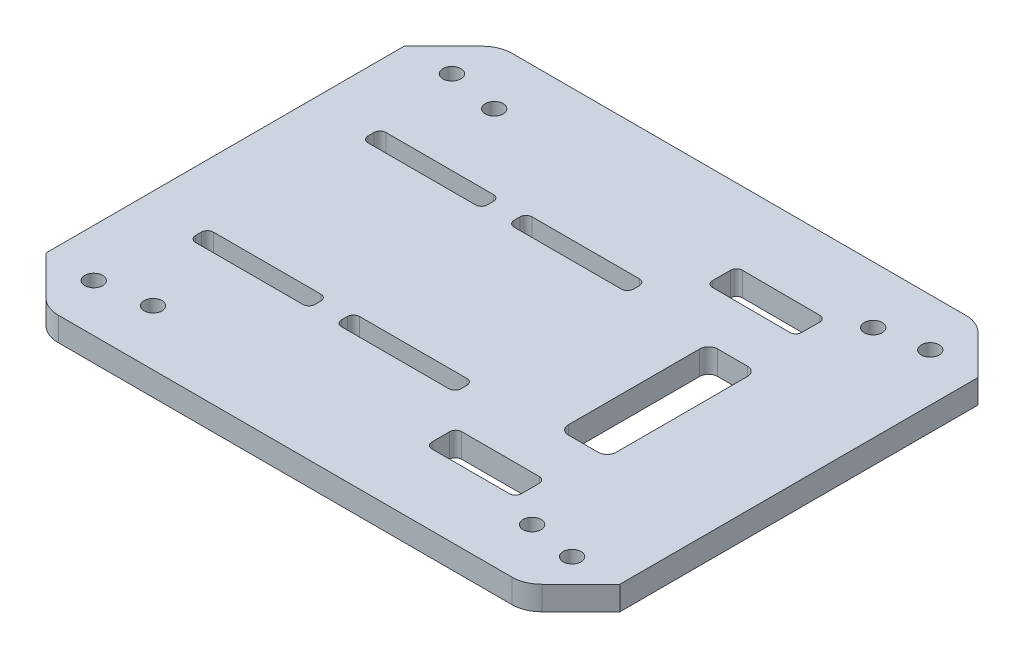
from build123d import *

# Parameters (mm, degrees)
SKETCH1_R           = 1.5
BOSS_EXTRUDE1_DEPTH = 4
SKETCH2_R           = 1.5
CUT_EXTRUDE1_DEPTH  = 10


with BuildPart() as part:
    # Sketch1 → Boss-Extrude1 (new body)
    with BuildSketch(Plane(origin=(0, 0, 0), x_dir=(1, 0, 0), z_dir=(0, 1, 0))):
        with BuildLine():
            Line((-48.071067812, 30), (-48.071067812, -30))
            Line((-48.071067812, -30), (-41.535533906, -36.535533906))
            ThreePointArc((-41.535533906, -36.535533906), (-39.913417162, -37.619397663), (-38, -38))
            Line((-38, -38), (38, -38))
            ThreePointArc((38, -38), (39.913417162, -37.619397663), (41.535533906, -36.535533906))
            Line((41.535533906, -36.535533906), (48.071067812, -30))
            Line((48.071067812, -30), (48.071067812, 30))
            Line((48.071067812, 30), (41.535533906, 36.535533906))
            ThreePointArc((41.535533906, 36.535533906), (39.913417162, 37.619397663), (38, 38))
            Line((38, 38), (-38, 38))
            ThreePointArc((-38, 38), (-39.913417162, 37.619397663), (-41.535533906, 36.535533906))
            Line((-41.535533906, 36.535533906), (-48.071067812, 30))
        make_face()
        with Locations(Location((32.059596398, -28.691611003, 0), (0, 0, 270))):
            Circle(SKETCH1_R, mode=Mode.SUBTRACT)
        with Locations(Location((32.059596398, 28.458388997, 0), (0, 0, 270))):
            Circle(SKETCH1_R, mode=Mode.SUBTRACT)
        with Locations(Location((-31.440403602, -28.691611003, 0), (0, 0, 270))):
            Circle(SKETCH1_R, mode=Mode.SUBTRACT)
        with Locations(Location((-31.440403602, 28.458388997, 0), (0, 0, 270))):
            Circle(SKETCH1_R, mode=Mode.SUBTRACT)
        with BuildLine():
            Line((26.770818028, 21.768665175), (26.783167828, 24.768639755))
            ThreePointArc((26.783167828, 24.768639755), (26.493187967, 25.476946269), (25.787292902, 25.772747882))
            Line((25.787292902, 25.772747882), (12.787403054, 25.826263684))
            ThreePointArc((12.787403054, 25.826263684), (12.07909654, 25.536283823), (11.783294927, 24.830388757))
            Line((11.783294927, 24.830388757), (11.770945126, 21.830414177))
            ThreePointArc((11.770945126, 21.830414177), (12.060924988, 21.122107663), (12.766820053, 20.82630605))
            Line((12.766820053, 20.82630605), (25.766709901, 20.772790248))
            ThreePointArc((25.766709901, 20.772790248), (26.475016415, 21.062770109), (26.770818028, 21.768665175))
        make_face(mode=Mode.SUBTRACT)
        with BuildLine():
            Line((28.613064126, -11.166765747), (28.613064126, 10.833234253))
            ThreePointArc((28.613064126, 10.833234253), (28.173724298, 11.893894425), (27.113064126, 12.333234253))
            Line((27.113064126, 12.333234253), (22.113064126, 12.333234253))
            ThreePointArc((22.113064126, 12.333234253), (21.052403954, 11.893894425), (20.613064126, 10.833234253))
            Line((20.613064126, 10.833234253), (20.613064126, -11.166765747))
            ThreePointArc((20.613064126, -11.166765747), (21.052403954, -12.227425919), (22.113064126, -12.666765747))
            Line((22.113064126, -12.666765747), (27.113064126, -12.666765747))
            ThreePointArc((27.113064126, -12.666765747), (28.173724298, -12.227425919), (28.613064126, -11.166765747))
        make_face(mode=Mode.SUBTRACT)
        with BuildLine():
            Line((26.680500347, -25.110893415), (26.680500347, -22.110893415))
            ThreePointArc((26.680500347, -22.110893415), (26.387607128, -21.403786634), (25.680500347, -21.110893415))
            Line((25.680500347, -21.110893415), (12.680500347, -21.110893415))
            ThreePointArc((12.680500347, -21.110893415), (11.973393565, -21.403786634), (11.680500347, -22.110893415))
            Line((11.680500347, -22.110893415), (11.680500347, -25.110893415))
            ThreePointArc((11.680500347, -25.110893415), (11.973393565, -25.818000196), (12.680500347, -26.110893415))
            Line((12.680500347, -26.110893415), (25.680500347, -26.110893415))
            ThreePointArc((25.680500347, -26.110893415), (26.387607128, -25.818000196), (26.680500347, -25.110893415))
        make_face(mode=Mode.SUBTRACT)
        with BuildLine():
            Line((-37.071067812, 15.952856913), (-19.071067812, 15.952856913))
            ThreePointArc((-19.071067812, 15.952856913), (-18.363961031, 15.659963694), (-18.071067812, 14.952856913))
            Line((-18.071067812, 14.952856913), (-18.071067812, 13.952856913))
            ThreePointArc((-18.071067812, 13.952856913), (-18.363961031, 13.245750131), (-19.071067812, 12.952856913))
            Line((-19.071067812, 12.952856913), (-37.071067812, 12.952856913))
            ThreePointArc((-37.071067812, 12.952856913), (-37.778174593, 13.245750131), (-38.071067812, 13.952856913))
            Line((-38.071067812, 13.952856913), (-38.071067812, 14.952856913))
            ThreePointArc((-38.071067812, 14.952856913), (-37.778174593, 15.659963694), (-37.071067812, 15.952856913))
        make_face(mode=Mode.SUBTRACT)
        with BuildLine():
            Line((6.394530071, 14.952856913), (6.394530071, 13.952856913))
            ThreePointArc((6.394530071, 13.952856913), (6.101636852, 13.245750131), (5.394530071, 12.952856913))
            Line((5.394530071, 12.952856913), (-12.605469929, 12.952856913))
            ThreePointArc((-12.605469929, 12.952856913), (-13.312576711, 13.245750131), (-13.605469929, 13.952856913))
            Line((-13.605469929, 13.952856913), (-13.605469929, 14.952856913))
            ThreePointArc((-13.605469929, 14.952856913), (-13.312576711, 15.659963694), (-12.605469929, 15.952856913))
            Line((-12.605469929, 15.952856913), (5.394530071, 15.952856913))
            ThreePointArc((5.394530071, 15.952856913), (6.101636852, 15.659963694), (6.394530071, 14.952856913))
        make_face(mode=Mode.SUBTRACT)
        with BuildLine():
            Line((-38.071067812, -14.952856913), (-38.071067812, -13.952856913))
            ThreePointArc((-38.071067812, -13.952856913), (-37.778174593, -13.245750131), (-37.071067812, -12.952856913))
            Line((-37.071067812, -12.952856913), (-19.071067812, -12.952856913))
            ThreePointArc((-19.071067812, -12.952856913), (-18.363961031, -13.245750131), (-18.071067812, -13.952856913))
            Line((-18.071067812, -13.952856913), (-18.071067812, -14.952856913))
            ThreePointArc((-18.071067812, -14.952856913), (-18.363961031, -15.659963694), (-19.071067812, -15.952856913))
            Line((-19.071067812, -15.952856913), (-37.071067812, -15.952856913))
            ThreePointArc((-37.071067812, -15.952856913), (-37.778174593, -15.659963694), (-38.071067812, -14.952856913))
        make_face(mode=Mode.SUBTRACT)
        with BuildLine():
            Line((-13.605469929, -14.952856913), (-13.605469929, -13.952856913))
            ThreePointArc((-13.605469929, -13.952856913), (-13.312576711, -13.245750131), (-12.605469929, -12.952856913))
            Line((-12.605469929, -12.952856913), (5.394530071, -12.952856913))
            ThreePointArc((5.394530071, -12.952856913), (6.101636852, -13.245750131), (6.394530071, -13.952856913))
            Line((6.394530071, -13.952856913), (6.394530071, -14.952856913))
            ThreePointArc((6.394530071, -14.952856913), (6.101636852, -15.659963694), (5.394530071, -15.952856913))
            Line((5.394530071, -15.952856913), (-12.605469929, -15.952856913))
            ThreePointArc((-12.605469929, -15.952856913), (-13.312576711, -15.659963694), (-13.605469929, -14.952856913))
        make_face(mode=Mode.SUBTRACT)
    extrude(amount=BOSS_EXTRUDE1_DEPTH)

    # Sketch2 → Cut-Extrude1 (cut)
    with BuildSketch(Plane(origin=(0, 4, 0), x_dir=(1, 0, 0), z_dir=(0, 1, 0))):
        with Locations(Location((-40.071067812, 30, 0), (0, 0, 270))):
            Circle(SKETCH2_R)
        with Locations(Location((40.071067812, 30, 0), (0, 0, 270))):
            Circle(SKETCH2_R)
        with Locations(Location((40.071067812, -30, 0), (0, 0, 270))):
            Circle(SKETCH2_R)
        with Locations(Location((-40.071067812, -30, 0), (0, 0, 270))):
            Circle(SKETCH2_R)
    extrude(amount=-CUT_EXTRUDE1_DEPTH, mode=Mode.SUBTRACT)


solid = part.part
